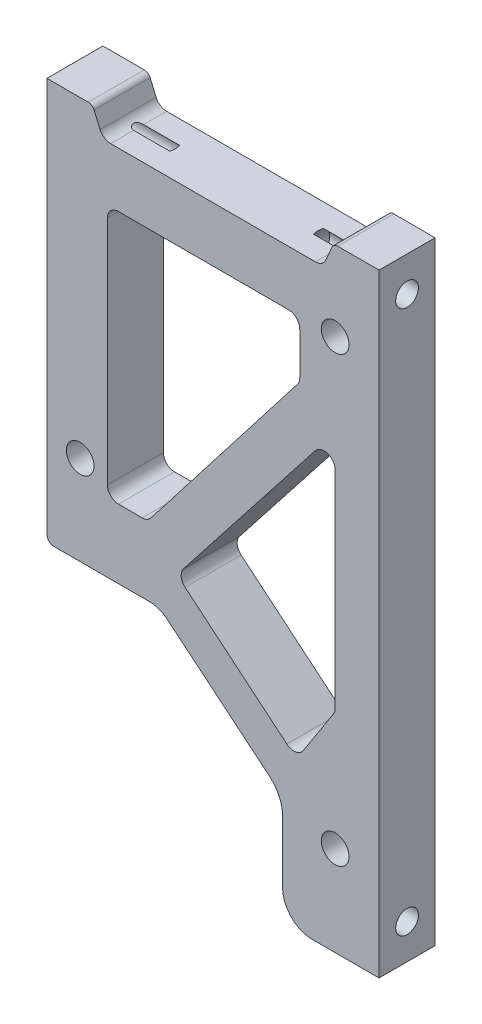
from build123d import *

# Parameters (mm, degrees)
ESTRUSIONE_ESTRUSIONE1_DEPTH     = 5.05
FORO_FILETTATO_M3X0_5_1_D        = 2.5
FORO_FILETTATO_M2_5X0_45_1_D     = 2.05
FORO_FILETTATO_M2_5X0_45_1_DEPTH = 8
FORO_FILETTATO_M2_5X0_45_1_TIP   = 0.615882135
FORO_FILETTATO_M2_5X0_45_2_D     = 2.05
FORO_FILETTATO_M2_5X0_45_2_DEPTH = 9
FORO_FILETTATO_M2_5X0_45_2_TIP   = 0.615882135


with BuildPart() as part:
    # Schizzo1 → Estrusione-Estrusione1 (new body)
    with BuildSketch(Plane.XY):
        with BuildLine():
            Line((33.607852656, 57.990136231), (15.135967017, 57.990136231))
            ThreePointArc((15.135967017, 57.990136231), (14.569863255, 58.159527321), (14.189841424, 58.612020655))
            Line((14.189841424, 58.612020655), (13.644681905, 59.873833883))
            ThreePointArc((13.644681905, 59.873833883), (13.434009359, 60.124682426), (13.12017865, 60.218587695))
            Line((13.12017865, 60.218587695), (9.391909837, 60.218587695))
            Line((9.391909837, 60.218587695), (9.391909837, 24.597853141))
            ThreePointArc((9.391909837, 24.597853141), (9.577563808, 24.149644804), (10.025772145, 23.963990832))
            Line((10.025772145, 23.963990832), (18.675714063, 23.963990832))
            ThreePointArc((18.675714063, 23.963990832), (19.485298036, 23.822640523), (20.199085336, 23.415315332))
            Line((20.199085336, 23.415315332), (29.426699127, 15.777448227))
            ThreePointArc((29.426699127, 15.777448227), (30.330003033, 14.612437653), (30.65149016, 13.173739071))
            Line((30.65149016, 13.173739071), (30.65149016, 7.610644322))
            ThreePointArc((30.65149016, 7.610644322), (31.43997529, 5.707072826), (33.343546787, 4.918587695))
            Line((33.343546787, 4.918587695), (39.351909837, 4.918587695))
            Line((39.351909837, 4.918587695), (39.351909837, 60.218587695))
            Line((39.351909837, 60.218587695), (35.623641023, 60.218587695))
            ThreePointArc((35.623641023, 60.218587695), (35.309810314, 60.124682426), (35.099137768, 59.873833883))
            Line((35.099137768, 59.873833883), (34.553978249, 58.612020655))
            ThreePointArc((34.553978249, 58.612020655), (34.173956418, 58.159527321), (33.607852656, 57.990136231))
        make_face()
        with BuildLine():
            Line((31.031517622, 19.035447222), (21.858166203, 26.68561737))
            ThreePointArc((21.858166203, 26.68561737), (21.50418026, 27.348416385), (21.711670705, 28.070604932))
            Line((21.711670705, 28.070604932), (33.604209018, 43.239087362))
            ThreePointArc((33.604209018, 43.239087362), (34.717543506, 43.567327143), (35.391171024, 42.622085902))
            Line((35.391171024, 42.622085902), (35.391171024, 24.021384648))
            ThreePointArc((35.391171024, 24.021384648), (35.35046365, 23.738970664), (35.231655708, 23.479549344))
            Line((35.231655708, 23.479549344), (32.512468814, 19.26159802))
            ThreePointArc((32.512468814, 19.26159802), (31.822940625, 18.814892917), (31.031517622, 19.035447222))
        make_face(mode=Mode.SUBTRACT)
        with BuildLine():
            Line((15.844806521, 53.037240639), (31.196511098, 53.037240639))
            ThreePointArc((31.196511098, 53.037240639), (31.90361788, 52.74434742), (32.196511098, 52.037240639))
            Line((32.196511098, 52.037240639), (32.196511098, 48.227218639))
            ThreePointArc((32.196511098, 48.227218639), (32.142658979, 47.90348389), (31.986902723, 47.614616745))
            Line((31.986902723, 47.614616745), (18.775971342, 30.569600026))
            ThreePointArc((18.775971342, 30.569600026), (18.425692263, 30.284259301), (17.985579717, 30.182201919))
            Line((17.985579717, 30.182201919), (15.844806521, 30.182201919))
            ThreePointArc((15.844806521, 30.182201919), (15.13769974, 30.475095138), (14.844806521, 31.182201919))
            Line((14.844806521, 31.182201919), (14.844806521, 52.037240639))
            ThreePointArc((14.844806521, 52.037240639), (15.13769974, 52.74434742), (15.844806521, 53.037240639))
        make_face(mode=Mode.SUBTRACT)
    extrude(amount=ESTRUSIONE_ESTRUSIONE1_DEPTH)

    # Foro filettato M3x0.5-1 (through all)
    with Locations(Plane.XY.offset(5.05)):
        with Locations((35.391171024, 53.037240639), (12.391171024, 32.037240639), (35.391171024, 13.037240639)):
            Hole(FORO_FILETTATO_M3X0_5_1_D / 2)

    # Foro filettato M2.5x0.45-1
    with Locations(Plane(origin=(39.351909837, 0, 0), x_dir=(0, 0, -1), z_dir=(1, 0, 0))):
        with Locations((-2.525, 57.068587695), (-2.525, 8.068587695)):
            Hole(FORO_FILETTATO_M2_5X0_45_1_D / 2, depth=FORO_FILETTATO_M2_5X0_45_1_DEPTH)
            with Locations((0, 0, -(FORO_FILETTATO_M2_5X0_45_1_DEPTH + FORO_FILETTATO_M2_5X0_45_1_TIP / 2))):  # 118° drill point
                Cone(0, FORO_FILETTATO_M2_5X0_45_1_D / 2, FORO_FILETTATO_M2_5X0_45_1_TIP, mode=Mode.SUBTRACT)

    # Foro filettato M2.5x0.45-2
    with Locations(Plane.ZY.offset(-9.391909837)):
        with Locations((2.525, 57.068587695), (2.525, 27.068587695)):
            Hole(FORO_FILETTATO_M2_5X0_45_2_D / 2, depth=FORO_FILETTATO_M2_5X0_45_2_DEPTH)
            with Locations((0, 0, -(FORO_FILETTATO_M2_5X0_45_2_DEPTH + FORO_FILETTATO_M2_5X0_45_2_TIP / 2))):  # 118° drill point
                Cone(0, FORO_FILETTATO_M2_5X0_45_2_D / 2, FORO_FILETTATO_M2_5X0_45_2_TIP, mode=Mode.SUBTRACT)


solid = part.part
